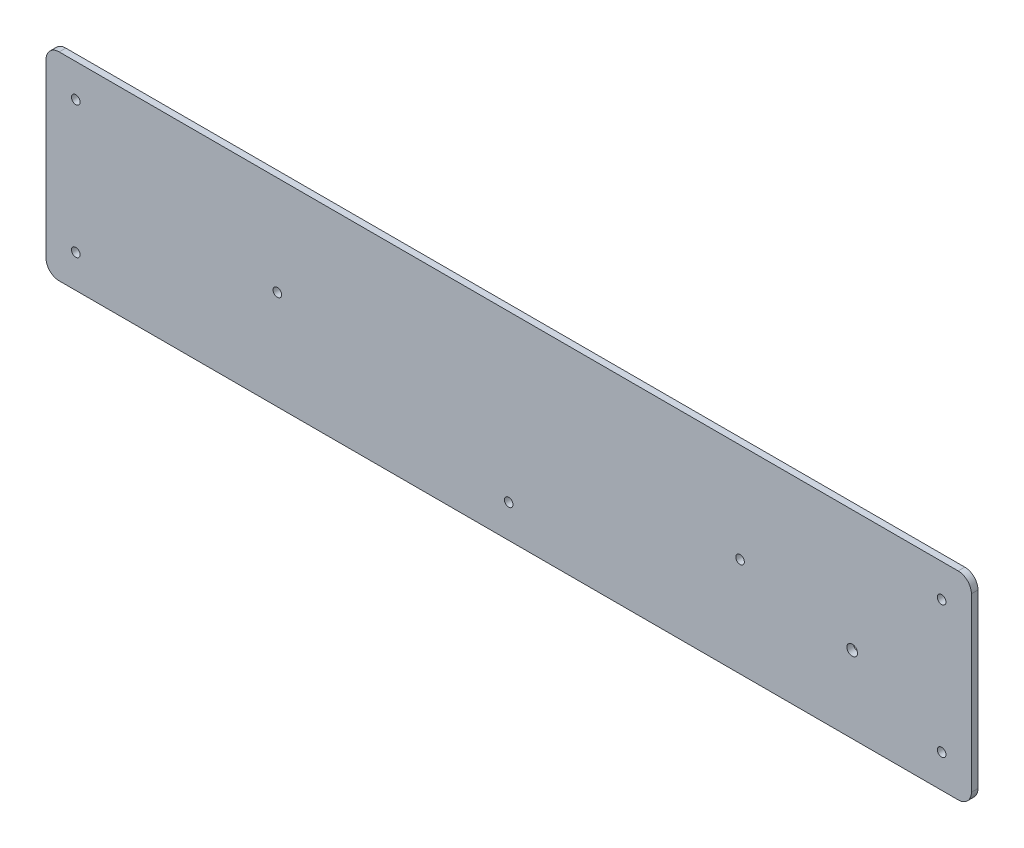
from build123d import *

# Parameters (mm, degrees)
SKETCH1_W           = 700
SKETCH1_H           = 150
BOSS_EXTRUDE1_DEPTH = 5
FILLET1_R           = 10
SKETCH3_R           = 3.25
CUT_EXTRUDE1_DEPTH  = 270
SKETCH4_R           = 4
CUT_EXTRUDE2_DEPTH  = 10
SKETCH5_R           = 4
BOSS_EXTRUDE2_DEPTH = 5
SKETCH6_R           = 4
CUT_EXTRUDE3_DEPTH  = 20


with BuildPart() as part:
    # Sketch1 → Boss-Extrude1 (new body)
    with BuildSketch(Plane.XY):
        Rectangle(SKETCH1_W, SKETCH1_H)
    extrude(amount=BOSS_EXTRUDE1_DEPTH)

    # Fillet1
    fillet1_edges = [part.edges().sort_by_distance(p)[0] for p in [
        (350, -75, 2.5),
        (-350, -75, 2.5),
        (-350, 75, 2.5),
        (350, 75, 2.5),
    ]]
    fillet(fillet1_edges, radius=FILLET1_R)

    # Sketch3 → Cut-Extrude1 (cut)
    with BuildSketch(Plane.XY.offset(5)):
        with Locations((0, -50)):
            Circle(SKETCH3_R)
        with Locations((-327.483802204, -50)):
            Circle(SKETCH3_R)
        with Locations((327.483802204, -50)):
            Circle(SKETCH3_R)
        with Locations((-327.483802204, 50)):
            Circle(SKETCH3_R)
        with Locations((-175, 0)):
            Circle(SKETCH3_R)
        with Locations((175, 0)):
            Circle(SKETCH3_R)
        with Locations((327.483802204, 50)):
            Circle(SKETCH3_R)
    extrude(amount=-CUT_EXTRUDE1_DEPTH, mode=Mode.SUBTRACT)

    # Sketch4 → Cut-Extrude2 (cut)
    with BuildSketch(Plane.XY.offset(5)):
        with Locations((245.65923276, -46.5)):
            Circle(SKETCH4_R)
    extrude(amount=-CUT_EXTRUDE2_DEPTH, mode=Mode.SUBTRACT)

    # Sketch5 → Boss-Extrude2 (add)
    with BuildSketch(Plane.XY.offset(5)):
        with Locations((245.65923276, -46.5)):
            Circle(SKETCH5_R)
    extrude(amount=-BOSS_EXTRUDE2_DEPTH)

    # Sketch6 → Cut-Extrude3 (cut)
    with BuildSketch(Plane.XY.offset(5)):
        with Locations((259.827830127, -16.962361372)):
            Circle(SKETCH6_R)
    extrude(amount=-CUT_EXTRUDE3_DEPTH, mode=Mode.SUBTRACT)


solid = part.part
